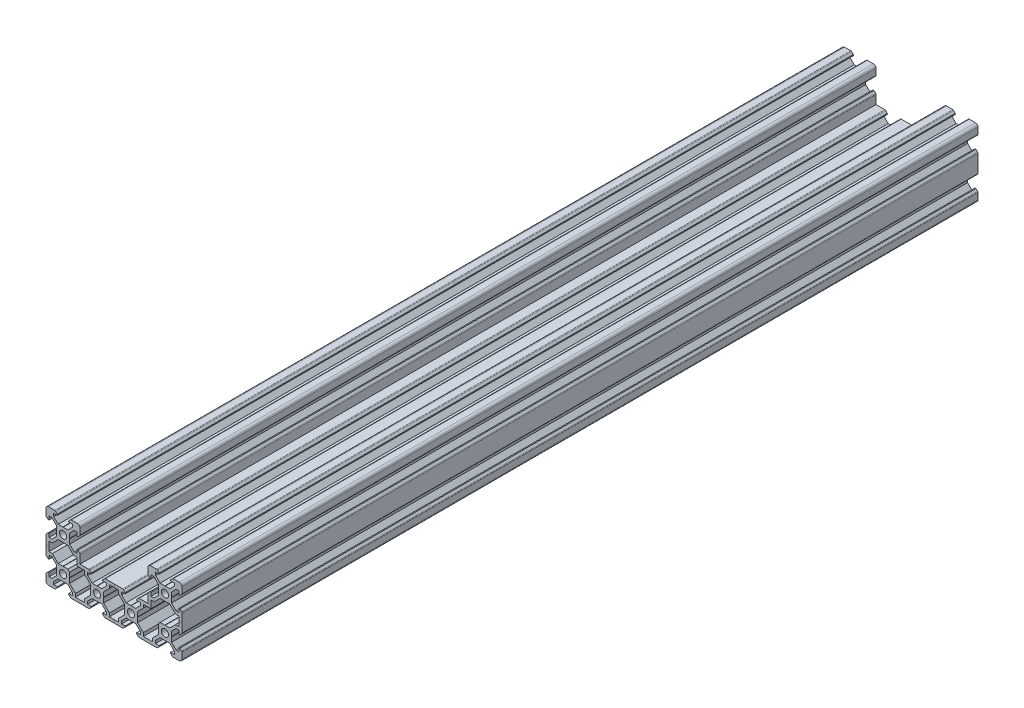
from build123d import *

# Parameters (mm, degrees)
SKETCH1_R           = 2.1
BOSS_EXTRUDE1_DEPTH = 468.54


with BuildPart() as part:
    # Sketch1 → Boss-Extrude1 (new body)
    with BuildSketch(Plane.XY):
        with BuildLine():
            Line((-2.8395, 3.9), (-0.1, 3.9))
            Line((-0.1, 3.9), (0, 3.8))
            Line((0, 3.8), (0.1, 3.9))
            Line((0.1, 3.9), (2.8395, 3.9))
            Line((2.8395, 3.9), (5.5005, 6.561))
            Line((5.5005, 6.561), (5.5005, 8.2))
            Line((5.5005, 8.2), (3.3865, 8.2))
            Line((3.3865, 8.2), (3.3865, 8.807))
            Line((3.3865, 8.807), (4.377060464, 9.797560464))
            ThreePointArc((4.377060464, 9.797560464), (4.601292737, 9.947387679), (4.865792737, 10))
            Line((4.865792737, 10), (8.5, 10))
            ThreePointArc((8.5, 10), (9.560660172, 9.560660172), (10, 8.5))
            Line((10, 8.5), (10, 4.862695796))
            ThreePointArc((10, 4.862695796), (9.947180343, 4.597695796), (9.796794374, 4.373198632))
            Line((9.796794374, 4.373198632), (8.807, 3.3865))
            Line((8.807, 3.3865), (8.2, 3.3865))
            Line((8.2, 3.3865), (8.2, 5.5005))
            Line((8.2, 5.5005), (6.561, 5.5005))
            Line((6.561, 5.5005), (3.9, 2.8395))
            Line((3.9, 2.8395), (3.9, 0.1))
            Line((3.9, 0.1), (3.8, 0))
            Line((3.8, 0), (3.9, -0.1))
            Line((3.9, -0.1), (3.9, -2.8395))
            Line((3.9, -2.8395), (6.561, -5.5005))
            Line((6.561, -5.5005), (8.2, -5.5005))
            Line((8.2, -5.5005), (8.2, -3.3865))
            Line((8.2, -3.3865), (8.807, -3.3865))
            Line((8.807, -3.3865), (9.797561312, -4.380169173))
            ThreePointArc((9.797561312, -4.380169173), (9.947396086, -4.604984013), (10, -4.869984013))
            Line((10, -4.869984013), (10, -10))
            Line((10, -10), (15.134207263, -10))
            ThreePointArc((15.134207263, -10), (15.398707263, -10.052612321), (15.622939536, -10.202439536))
            Line((15.622939536, -10.202439536), (16.6135, -11.193))
            Line((16.6135, -11.193), (16.6135, -11.8))
            Line((16.6135, -11.8), (14.4995, -11.8))
            Line((14.4995, -11.8), (14.4995, -13.439))
            Line((14.4995, -13.439), (17.1605, -16.1))
            Line((17.1605, -16.1), (19.9, -16.1))
            Line((19.9, -16.1), (20, -16.2))
            Line((20, -16.2), (20.1, -16.1))
            Line((20.1, -16.1), (22.8395, -16.1))
            Line((22.8395, -16.1), (25.5005, -13.439))
            Line((25.5005, -13.439), (25.5005, -11.8))
            Line((25.5005, -11.8), (23.3865, -11.8))
            Line((23.3865, -11.8), (23.3865, -11.193))
            Line((23.3865, -11.193), (24.377060464, -10.202439536))
            ThreePointArc((24.377060464, -10.202439536), (24.601292737, -10.052612321), (24.865792737, -10))
            Line((24.865792737, -10), (30, -10))
            Line((30, -10), (35.134207263, -10))
            ThreePointArc((35.134207263, -10), (35.398707263, -10.052612321), (35.622939536, -10.202439536))
            Line((35.622939536, -10.202439536), (36.6135, -11.193))
            Line((36.6135, -11.193), (36.6135, -11.8))
            Line((36.6135, -11.8), (34.4995, -11.8))
            Line((34.4995, -11.8), (34.4995, -13.439))
            Line((34.4995, -13.439), (37.1605, -16.1))
            Line((37.1605, -16.1), (39.9, -16.1))
            Line((39.9, -16.1), (40, -16.2))
            Line((40, -16.2), (40.1, -16.1))
            Line((40.1, -16.1), (42.8395, -16.1))
            Line((42.8395, -16.1), (45.5005, -13.439))
            Line((45.5005, -13.439), (45.5005, -11.8))
            Line((45.5005, -11.8), (43.3865, -11.8))
            Line((43.3865, -11.8), (43.3865, -11.193))
            Line((43.3865, -11.193), (44.377060464, -10.202439536))
            ThreePointArc((44.377060464, -10.202439536), (44.601292737, -10.052612321), (44.865792737, -10))
            Line((44.865792737, -10), (50, -10))
            Line((50, -10), (50, -4.869984013))
            ThreePointArc((50, -4.869984013), (50.052603914, -4.604984013), (50.202438688, -4.380169173))
            Line((50.202438688, -4.380169173), (51.193, -3.3865))
            Line((51.193, -3.3865), (51.8, -3.3865))
            Line((51.8, -3.3865), (51.8, -5.5005))
            Line((51.8, -5.5005), (53.439, -5.5005))
            Line((53.439, -5.5005), (56.1, -2.8395))
            Line((56.1, -2.8395), (56.1, -0.1))
            Line((56.1, -0.1), (56.2, 0))
            Line((56.2, 0), (56.1, 0.1))
            Line((56.1, 0.1), (56.1, 2.8395))
            Line((56.1, 2.8395), (53.439, 5.5005))
            Line((53.439, 5.5005), (51.8, 5.5005))
            Line((51.8, 5.5005), (51.8, 3.3865))
            Line((51.8, 3.3865), (51.193, 3.3865))
            Line((51.193, 3.3865), (50.203205626, 4.373198632))
            ThreePointArc((50.203205626, 4.373198632), (50.052819657, 4.597695796), (50, 4.862695796))
            Line((50, 4.862695796), (50, 8.5))
            ThreePointArc((50, 8.5), (50.439339828, 9.560660172), (51.5, 10))
            Line((51.5, 10), (55.134207263, 10))
            ThreePointArc((55.134207263, 10), (55.398707263, 9.947387679), (55.622939536, 9.797560464))
            Line((55.622939536, 9.797560464), (56.6135, 8.807))
            Line((56.6135, 8.807), (56.6135, 8.2))
            Line((56.6135, 8.2), (54.4995, 8.2))
            Line((54.4995, 8.2), (54.4995, 6.561))
            Line((54.4995, 6.561), (57.1605, 3.9))
            Line((57.1605, 3.9), (59.9, 3.9))
            Line((59.9, 3.9), (60, 3.8))
            Line((60, 3.8), (60.1, 3.9))
            Line((60.1, 3.9), (62.8395, 3.9))
            Line((62.8395, 3.9), (65.5005, 6.561))
            Line((65.5005, 6.561), (65.5005, 8.2))
            Line((65.5005, 8.2), (63.3865, 8.2))
            Line((63.3865, 8.2), (63.3865, 8.807))
            Line((63.3865, 8.807), (64.377060464, 9.797560464))
            ThreePointArc((64.377060464, 9.797560464), (64.601292737, 9.947387679), (64.865792737, 10))
            Line((64.865792737, 10), (68.5, 10))
            ThreePointArc((68.5, 10), (69.560660172, 9.560660172), (70, 8.5))
            Line((70, 8.5), (70, 4.862695796))
            ThreePointArc((70, 4.862695796), (69.947180343, 4.597695796), (69.796794374, 4.373198632))
            Line((69.796794374, 4.373198632), (68.807, 3.3865))
            Line((68.807, 3.3865), (68.2, 3.3865))
            Line((68.2, 3.3865), (68.2, 5.5005))
            Line((68.2, 5.5005), (66.561, 5.5005))
            Line((66.561, 5.5005), (63.9, 2.8395))
            Line((63.9, 2.8395), (63.9, 0.1))
            Line((63.9, 0.1), (63.8, 0))
            Line((63.8, 0), (63.9, -0.1))
            Line((63.9, -0.1), (63.9, -2.8395))
            Line((63.9, -2.8395), (66.561, -5.5005))
            Line((66.561, -5.5005), (68.2, -5.5005))
            Line((68.2, -5.5005), (68.2, -3.3865))
            Line((68.2, -3.3865), (68.807, -3.3865))
            Line((68.807, -3.3865), (69.797561312, -4.380169173))
            ThreePointArc((69.797561312, -4.380169173), (69.947396086, -4.604984013), (70, -4.869984013))
            Line((70, -4.869984013), (70, -15.130015987))
            ThreePointArc((70, -15.130015987), (69.947396086, -15.395015987), (69.797561312, -15.619830827))
            Line((69.797561312, -15.619830827), (68.807, -16.6135))
            Line((68.807, -16.6135), (68.2, -16.6135))
            Line((68.2, -16.6135), (68.2, -14.4995))
            Line((68.2, -14.4995), (66.561, -14.4995))
            Line((66.561, -14.4995), (63.9, -17.1605))
            Line((63.9, -17.1605), (63.9, -19.9))
            Line((63.9, -19.9), (63.8, -20))
            Line((63.8, -20), (63.9, -20.1))
            Line((63.9, -20.1), (63.9, -22.8395))
            Line((63.9, -22.8395), (66.561, -25.5005))
            Line((66.561, -25.5005), (68.2, -25.5005))
            Line((68.2, -25.5005), (68.2, -23.3865))
            Line((68.2, -23.3865), (68.807, -23.3865))
            Line((68.807, -23.3865), (69.796794374, -24.373198632))
            ThreePointArc((69.796794374, -24.373198632), (69.947180343, -24.597695796), (70, -24.862695796))
            Line((70, -24.862695796), (70, -28.5))
            ThreePointArc((70, -28.5), (69.560660172, -29.560660172), (68.5, -30))
            Line((68.5, -30), (64.865792737, -30))
            ThreePointArc((64.865792737, -30), (64.601292737, -29.947387679), (64.377060464, -29.797560464))
            Line((64.377060464, -29.797560464), (63.3865, -28.807))
            Line((63.3865, -28.807), (63.3865, -28.2))
            Line((63.3865, -28.2), (65.5005, -28.2))
            Line((65.5005, -28.2), (65.5005, -26.561))
            Line((65.5005, -26.561), (62.8395, -23.9))
            Line((62.8395, -23.9), (60.1, -23.9))
            Line((60.1, -23.9), (60, -23.8))
            Line((60, -23.8), (59.9, -23.9))
            Line((59.9, -23.9), (57.1605, -23.9))
            Line((57.1605, -23.9), (54.4995, -26.561))
            Line((54.4995, -26.561), (54.4995, -28.2))
            Line((54.4995, -28.2), (56.6135, -28.2))
            Line((56.6135, -28.2), (56.6135, -28.807))
            Line((56.6135, -28.807), (55.622939536, -29.797560464))
            ThreePointArc((55.622939536, -29.797560464), (55.398707263, -29.947387679), (55.134207263, -30))
            Line((55.134207263, -30), (50, -30))
            Line((50, -30), (44.865792737, -30))
            ThreePointArc((44.865792737, -30), (44.601292737, -29.947387679), (44.377060464, -29.797560464))
            Line((44.377060464, -29.797560464), (43.3865, -28.807))
            Line((43.3865, -28.807), (43.3865, -28.2))
            Line((43.3865, -28.2), (45.5005, -28.2))
            Line((45.5005, -28.2), (45.5005, -26.561))
            Line((45.5005, -26.561), (42.8395, -23.9))
            Line((42.8395, -23.9), (40.1, -23.9))
            Line((40.1, -23.9), (40, -23.8))
            Line((40, -23.8), (39.9, -23.9))
            Line((39.9, -23.9), (37.1605, -23.9))
            Line((37.1605, -23.9), (34.4995, -26.561))
            Line((34.4995, -26.561), (34.4995, -28.2))
            Line((34.4995, -28.2), (36.6135, -28.2))
            Line((36.6135, -28.2), (36.6135, -28.807))
            Line((36.6135, -28.807), (35.622939536, -29.797560464))
            ThreePointArc((35.622939536, -29.797560464), (35.398707263, -29.947387679), (35.134207263, -30))
            Line((35.134207263, -30), (30, -30))
            Line((30, -30), (24.865792737, -30))
            ThreePointArc((24.865792737, -30), (24.601292737, -29.947387679), (24.377060464, -29.797560464))
            Line((24.377060464, -29.797560464), (23.3865, -28.807))
            Line((23.3865, -28.807), (23.3865, -28.2))
            Line((23.3865, -28.2), (25.5005, -28.2))
            Line((25.5005, -28.2), (25.5005, -26.561))
            Line((25.5005, -26.561), (22.8395, -23.9))
            Line((22.8395, -23.9), (20.1, -23.9))
            Line((20.1, -23.9), (20, -23.8))
            Line((20, -23.8), (19.9, -23.9))
            Line((19.9, -23.9), (17.1605, -23.9))
            Line((17.1605, -23.9), (14.4995, -26.561))
            Line((14.4995, -26.561), (14.4995, -28.2))
            Line((14.4995, -28.2), (16.6135, -28.2))
            Line((16.6135, -28.2), (16.6135, -28.807))
            Line((16.6135, -28.807), (15.622939536, -29.797560464))
            ThreePointArc((15.622939536, -29.797560464), (15.398707263, -29.947387679), (15.134207263, -30))
            Line((15.134207263, -30), (10, -30))
            Line((10, -30), (4.865792737, -30))
            ThreePointArc((4.865792737, -30), (4.601292737, -29.947387679), (4.377060464, -29.797560464))
            Line((4.377060464, -29.797560464), (3.3865, -28.807))
            Line((3.3865, -28.807), (3.3865, -28.2))
            Line((3.3865, -28.2), (5.5005, -28.2))
            Line((5.5005, -28.2), (5.5005, -26.561))
            Line((5.5005, -26.561), (2.8395, -23.9))
            Line((2.8395, -23.9), (0.1, -23.9))
            Line((0.1, -23.9), (0, -23.8))
            Line((0, -23.8), (-0.1, -23.9))
            Line((-0.1, -23.9), (-2.8395, -23.9))
            Line((-2.8395, -23.9), (-5.5005, -26.561))
            Line((-5.5005, -26.561), (-5.5005, -28.2))
            Line((-5.5005, -28.2), (-3.3865, -28.2))
            Line((-3.3865, -28.2), (-3.3865, -28.807))
            Line((-3.3865, -28.807), (-4.377060464, -29.797560464))
            ThreePointArc((-4.377060464, -29.797560464), (-4.601292737, -29.947387679), (-4.865792737, -30))
            Line((-4.865792737, -30), (-8.5, -30))
            ThreePointArc((-8.5, -30), (-9.560660172, -29.560660172), (-10, -28.5))
            Line((-10, -28.5), (-10, -24.862695796))
            ThreePointArc((-10, -24.862695796), (-9.947180343, -24.597695796), (-9.796794374, -24.373198632))
            Line((-9.796794374, -24.373198632), (-8.807, -23.3865))
            Line((-8.807, -23.3865), (-8.2, -23.3865))
            Line((-8.2, -23.3865), (-8.2, -25.5005))
            Line((-8.2, -25.5005), (-6.561, -25.5005))
            Line((-6.561, -25.5005), (-3.9, -22.8395))
            Line((-3.9, -22.8395), (-3.9, -20.1))
            Line((-3.9, -20.1), (-3.8, -20))
            Line((-3.8, -20), (-3.9, -19.9))
            Line((-3.9, -19.9), (-3.9, -17.1605))
            Line((-3.9, -17.1605), (-6.561, -14.4995))
            Line((-6.561, -14.4995), (-8.2, -14.4995))
            Line((-8.2, -14.4995), (-8.2, -16.6135))
            Line((-8.2, -16.6135), (-8.807, -16.6135))
            Line((-8.807, -16.6135), (-9.797561312, -15.619830827))
            ThreePointArc((-9.797561312, -15.619830827), (-9.947396086, -15.395015987), (-10, -15.130015987))
            Line((-10, -15.130015987), (-10, -4.869984013))
            ThreePointArc((-10, -4.869984013), (-9.947396086, -4.604984013), (-9.797561312, -4.380169173))
            Line((-9.797561312, -4.380169173), (-8.807, -3.3865))
            Line((-8.807, -3.3865), (-8.2, -3.3865))
            Line((-8.2, -3.3865), (-8.2, -5.5005))
            Line((-8.2, -5.5005), (-6.561, -5.5005))
            Line((-6.561, -5.5005), (-3.9, -2.8395))
            Line((-3.9, -2.8395), (-3.9, -0.1))
            Line((-3.9, -0.1), (-3.8, 0))
            Line((-3.8, 0), (-3.9, 0.1))
            Line((-3.9, 0.1), (-3.9, 2.8395))
            Line((-3.9, 2.8395), (-6.561, 5.5005))
            Line((-6.561, 5.5005), (-8.2, 5.5005))
            Line((-8.2, 5.5005), (-8.2, 3.3865))
            Line((-8.2, 3.3865), (-8.807, 3.3865))
            Line((-8.807, 3.3865), (-9.796794374, 4.373198632))
            ThreePointArc((-9.796794374, 4.373198632), (-9.947180343, 4.597695796), (-10, 4.862695796))
            Line((-10, 4.862695796), (-10, 8.5))
            ThreePointArc((-10, 8.5), (-9.560660172, 9.560660172), (-8.5, 10))
            Line((-8.5, 10), (-4.865792737, 10))
            ThreePointArc((-4.865792737, 10), (-4.601292737, 9.947387679), (-4.377060464, 9.797560464))
            Line((-4.377060464, 9.797560464), (-3.3865, 8.807))
            Line((-3.3865, 8.807), (-3.3865, 8.2))
            Line((-3.3865, 8.2), (-5.5005, 8.2))
            Line((-5.5005, 8.2), (-5.5005, 6.561))
            Line((-5.5005, 6.561), (-2.8395, 3.9))
        make_face()
        Circle(SKETCH1_R, mode=Mode.SUBTRACT)
        with Locations((0, -20)):
            Circle(SKETCH1_R, mode=Mode.SUBTRACT)
        with Locations((20, -20)):
            Circle(SKETCH1_R, mode=Mode.SUBTRACT)
        with Locations((60, 0)):
            Circle(SKETCH1_R, mode=Mode.SUBTRACT)
        with Locations((60, -20)):
            Circle(SKETCH1_R, mode=Mode.SUBTRACT)
        with Locations((40, -20)):
            Circle(SKETCH1_R, mode=Mode.SUBTRACT)
        Polygon((-2.8395, -3.9), (-0.1, -3.9), (0, -3.8), (0.1, -3.9), (2.8395, -3.9), (5.5005, -6.561), (6.24, -7.3005), (8.2, -7.3005), (8.2, -11.8), (12.6995, -11.8), (12.6995, -13.76), (16.1, -17.1605), (16.1, -19.9), (16.2, -20), (16.1, -20.1), (16.1, -22.8395), (12.6995, -26.24), (12.6995, -28.2), (7.3005, -28.2), (7.3005, -26.24), (3.9, -22.8395), (3.9, -20.1), (3.8, -20), (3.9, -19.9), (3.9, -17.1605), (2.8395, -16.1), (0.1, -16.1), (0, -16.2), (-0.1, -16.1), (-2.8395, -16.1), (-6.24, -12.6995), (-8.2, -12.6995), (-8.2, -7.3005), (-6.24, -7.3005), (-5.5005, -6.561), align=None, mode=Mode.SUBTRACT)
        Polygon((23.9, -19.9), (23.9, -17.1605), (27.3005, -13.76), (27.3005, -11.8), (32.6995, -11.8), (32.6995, -13.76), (36.1, -17.1605), (36.1, -19.9), (36.2, -20), (36.1, -20.1), (36.1, -22.8395), (32.6995, -26.24), (32.6995, -28.2), (27.3005, -28.2), (27.3005, -26.24), (23.9, -22.8395), (23.9, -20.1), (23.8, -20), align=None, mode=Mode.SUBTRACT)
        Polygon((60, -3.8), (59.9, -3.9), (57.1605, -3.9), (54.4995, -6.561), (53.76, -7.3005), (51.8, -7.3005), (51.8, -11.8), (47.3005, -11.8), (47.3005, -13.76), (43.9, -17.1605), (43.9, -19.9), (43.8, -20), (43.9, -20.1), (43.9, -22.8395), (47.3005, -26.24), (47.3005, -28.2), (52.6995, -28.2), (52.6995, -26.24), (56.1, -22.8395), (56.1, -20.1), (56.2, -20), (56.1, -19.9), (56.1, -17.1605), (57.1605, -16.1), (59.9, -16.1), (60, -16.2), (60.1, -16.1), (62.8395, -16.1), (66.24, -12.6995), (68.2, -12.6995), (68.2, -7.3005), (66.24, -7.3005), (65.5005, -6.561), (62.8395, -3.9), (60.1, -3.9), align=None, mode=Mode.SUBTRACT)
    extrude(amount=BOSS_EXTRUDE1_DEPTH)


solid = part.part
